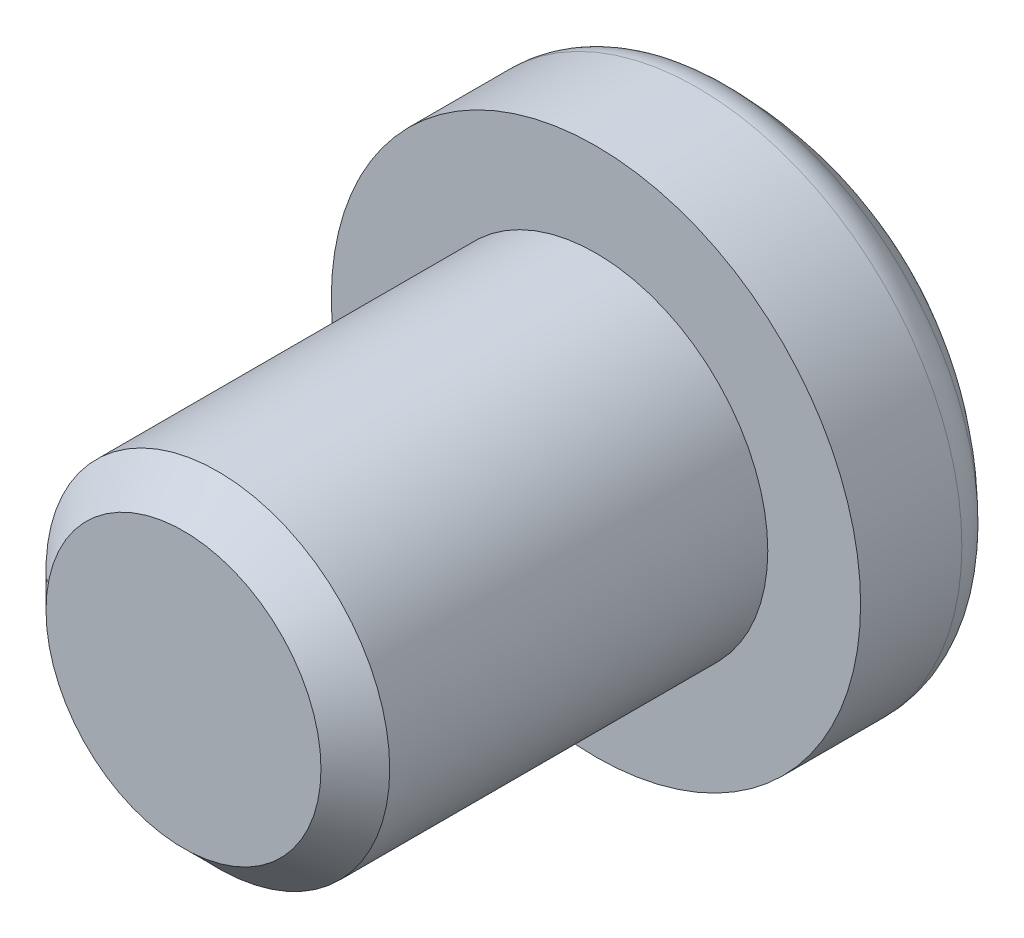
from build123d import *

# Parameters (mm, degrees)
ENLEV_MAT_EXTRU_1_DEPTH = 1.2
ESQUISSE3_W             = 2.5
ESQUISSE3_H             = 6
CHANFREIN1_SIZE         = 0.5
ENL_V_MAT_EXTRU_1_DEPTH = 2


with BuildPart() as part:
    # Esquisse1 → Base-Révolution (revolve)
    with BuildSketch(Plane(origin=(0, 0, 0), x_dir=(1, 0, 0), z_dir=(0, 1, 0))):
        with BuildLine():
            Line((0, 0), (3.85, 0))
            Line((3.85, 0), (3.85, 1.47314887))
            ThreePointArc((3.85, 1.47314887), (3.806875399, 1.689977873), (3.684065354, 1.873804531))
            ThreePointArc((3.684065354, 1.873804531), (1.993841151, 3.003350962), (0, 3.4))
            Line((0, 3.4), (0, 0))
        make_face()
    revolve(axis=Axis((0, 0, 0), (0, 0, -1)))

    # Esquisse2 → Enlev. mat.-Extru.1 (cut)
    with BuildSketch(Plane.XY.offset(-3.4)):
        Polygon((0.6, -0.6), (0.6, -2.35), (-0.6, -2.35), (-0.6, -0.6), (-2.35, -0.6), (-2.35, 0.6), (-0.6, 0.6), (-0.6, 2.35), (0.6, 2.35), (0.6, 0.6), (2.35, 0.6), (2.35, -0.6), align=None)
    extrude(amount=ENLEV_MAT_EXTRU_1_DEPTH, mode=Mode.SUBTRACT)

    # Esquisse3 → Boss.-Révol.1 (revolve)
    with BuildSketch(Plane(origin=(0, 0, 0), x_dir=(1, 0, 0), z_dir=(0, 1, 0))):
        with Locations((1.25, -3)):
            Rectangle(ESQUISSE3_W, ESQUISSE3_H)
    revolve(axis=Axis((0, 0, 0), (0, 0, 1)))

    # Chanfrein1
    chanfrein1_edges = [part.edges().sort_by_distance(p)[0] for p in [
        (-2.5, 0, 6),
    ]]
    chamfer(chanfrein1_edges, length=CHANFREIN1_SIZE)

    # Esquisse6 → Enlèv. mat.-Extru.1 (cut)
    with BuildSketch(Plane(origin=(0, 0, -2.2), x_dir=(-1, 0, 0), z_dir=(0, 0, -1))):
        Polygon((2.35, -0.6), (2.35, 0.6), (0.6, 0.6), (0.6, 2.35), (-0.6, 2.35), (-0.6, 0.6), (-2.35, 0.6), (-2.35, -0.6), (-0.6, -0.6), (-0.6, -2.35), (0.6, -2.35), (0.6, -0.6), align=None)
    extrude(amount=-ENL_V_MAT_EXTRU_1_DEPTH, mode=Mode.SUBTRACT)


solid = part.part
